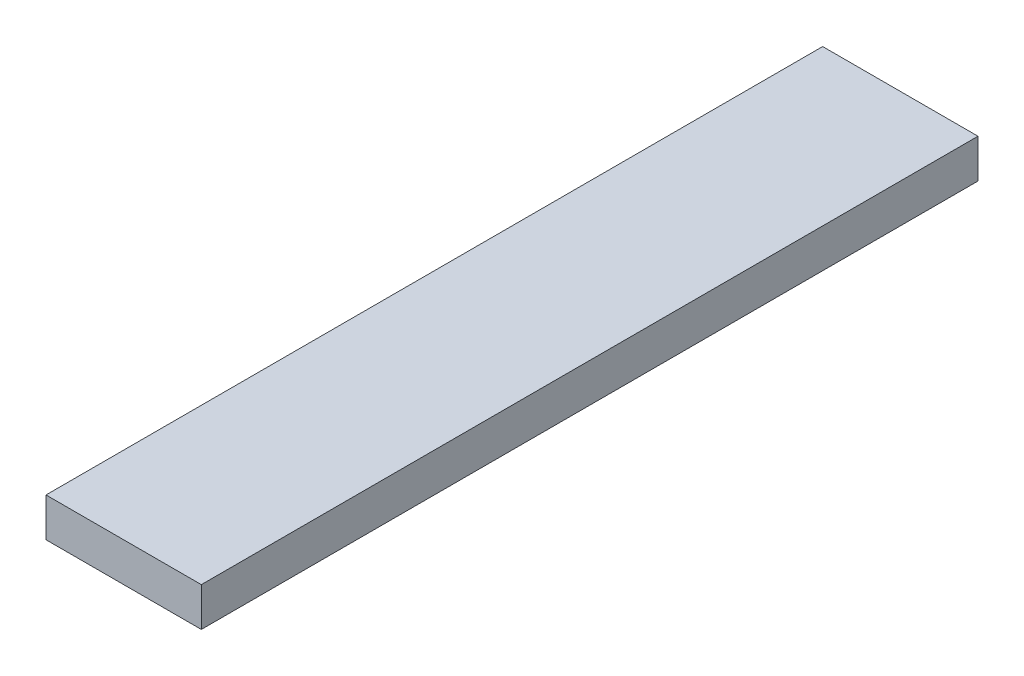
from build123d import *

# Parameters (mm, degrees)
SKETCH1_W           = 304.8
SKETCH1_H           = 304.8
BOSS_EXTRUDE1_DEPTH = 6.35
CUT_EXTRUDE2_DEPTH  = 6.35


with BuildPart() as part:
    # Sketch1 → Boss-Extrude1 (new body)
    with BuildSketch(Plane(origin=(0, 0, 0), x_dir=(1, 0, 0), z_dir=(0, 1, 0))):
        with Locations((152.4, 152.4)):
            Rectangle(SKETCH1_W, SKETCH1_H)
    extrude(amount=BOSS_EXTRUDE1_DEPTH)

    # Sketch2 → Cut-Extrude2 (cut)
    with BuildSketch(Plane(origin=(0, 6.35, 0), x_dir=(1, 0, 0), z_dir=(0, 1, 0))):
        Polygon((25.4, 304.8), (25.4, 177.8), (0, 177.8), (0, 0), (304.8, 0), (304.8, 304.8), align=None)
    extrude(amount=-CUT_EXTRUDE2_DEPTH, mode=Mode.SUBTRACT)


solid = part.part
